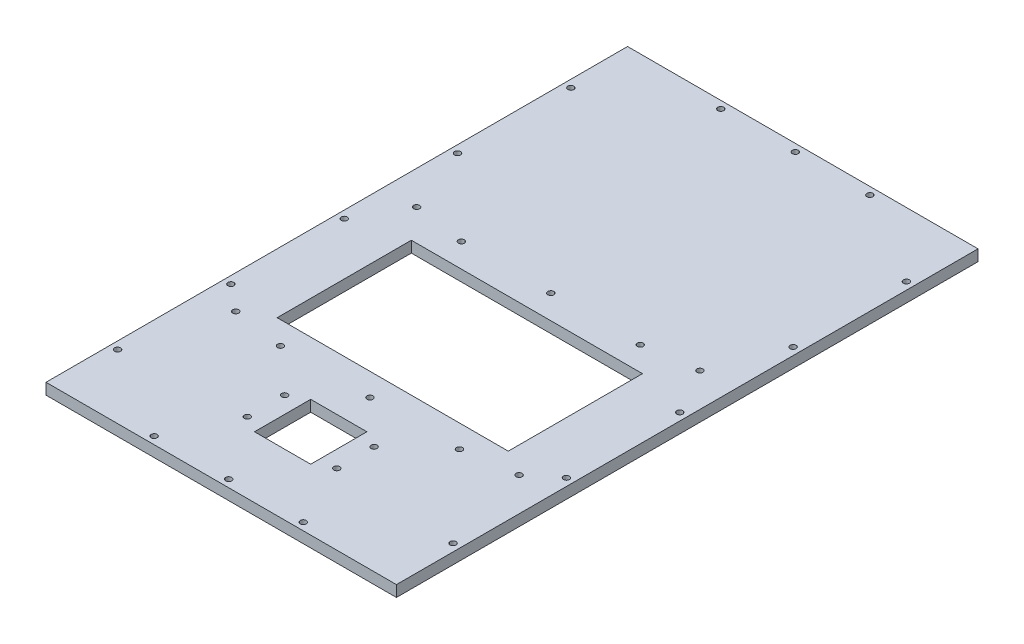
from build123d import *

# Parameters (mm, degrees)
SKETCH1_W                  = 298.45
SKETCH1_H                  = 495.3
BOSS_EXTRUDE1_DEPTH        = 4.7625
CUT_EXTRUDE1_DEPTH         = 290.291114191
CUT_EXTRUDE1_DEPTH_BACK    = 290.291114191
SKETCH3_W                  = 196.85
SKETCH3_H                  = 114.3
SKETCH20_W                 = 47.879
SKETCH20_H                 = 47.879
CUT_EXTRUDE5_DEPTH         = 290.291114191
F_10_CLEARANCE_HOLE1_D     = 5.1054
F_10_CLEARANCE_HOLE1_DEPTH = 10.668
F_10_CLEARANCE_HOLE1_TIP   = 1.533816902
F_10_CLEARANCE_HOLE4_D     = 5.1054
LPATTERN3_COUNT            = 3
LPATTERN3_PITCH            = 63.5
MIRROR2_COPY_1_D           = 5.1054
MIRROR2_COPY_2_D           = 5.1054
F_10_CLEARANCE_HOLE5_D     = 5.1054
LPATTERN4_COUNT            = 3
LPATTERN4_PITCH            = 96.52
LPATTERN4_COL_COUNT        = 3
LPATTERN4_COL_PITCH        = 96.52
MIRROR3_COPY_1_D           = 5.1054
MIRROR3_COPY_2_D           = 5.1054
MIRROR3_COPY_3_D           = 5.1054
MIRROR3_COPY_4_D           = 5.1054
F_10_CLEARANCE_HOLE6_D     = 5.1054
F_10_CLEARANCE_HOLE7_D     = 5.1054


with BuildPart() as part:
    # Sketch1 → Boss-Extrude1 (new, symmetric)
    with BuildSketch(Plane(origin=(0, 0, 0), x_dir=(1, 0, 0), z_dir=(0, 1, 0))):
        Rectangle(SKETCH1_W, SKETCH1_H)
    extrude(amount=BOSS_EXTRUDE1_DEPTH, both=True)

    # Sketch3 → Cut-Extrude1 (cut, two sides: drawn at the far end of the back side and taken through both)
    with BuildSketch(Plane(origin=(0, 4.7625, 0), x_dir=(1, 0, 0), z_dir=(0, 1, 0)).offset(-CUT_EXTRUDE1_DEPTH_BACK)):
        with Locations((0, -44.45)):
            Rectangle(SKETCH3_W, SKETCH3_H)
    extrude(amount=CUT_EXTRUDE1_DEPTH + CUT_EXTRUDE1_DEPTH_BACK, mode=Mode.SUBTRACT)

    # Sketch20 → Cut-Extrude5 (cut, through all)
    with BuildSketch(Plane.XZ.offset(4.7625)):
        with Locations((0, 171.45)):
            Rectangle(SKETCH20_W, SKETCH20_H)
    extrude(amount=-CUT_EXTRUDE5_DEPTH, mode=Mode.SUBTRACT)

    # #10 Clearance Hole1
    with Locations(Plane(origin=(0, -4.7625, 0), x_dir=(-1, 0, 0), z_dir=(0, -1, 0))):
        with Locations((-38.1, -155.575), (38.1, -155.575), (38.1, -187.325), (-38.1, -187.325)):
            Hole(F_10_CLEARANCE_HOLE1_D / 2, depth=F_10_CLEARANCE_HOLE1_DEPTH)
            with Locations((0, 0, -(F_10_CLEARANCE_HOLE1_DEPTH + F_10_CLEARANCE_HOLE1_TIP / 2))):  # 118° drill point
                Cone(0, F_10_CLEARANCE_HOLE1_D / 2, F_10_CLEARANCE_HOLE1_TIP, mode=Mode.SUBTRACT)

    # #10 Clearance Hole4 (through all)
    with Locations(Plane(origin=(0, 4.7625, 0), x_dir=(1, 0, 0), z_dir=(0, 1, 0))):
        with Locations((-63.5, 241.3)):
            f_10_clearance_hole4 = Hole(F_10_CLEARANCE_HOLE4_D / 2)

    # LPattern3: #10 Clearance Hole4 ×3
    with Locations(*[(i * LPATTERN3_PITCH, 0, 0) for i in range(1, LPATTERN3_COUNT)]):
        add(f_10_clearance_hole4, mode=Mode.SUBTRACT)

    # Mirror2: #10 Clearance Hole4 across plane
    add(f_10_clearance_hole4.mirror(Plane.XY), mode=Mode.SUBTRACT)

    # Mirror2 copy 1 (through all)
    with Locations(Plane(origin=(63.5, 4.7625, 0), x_dir=(1, 0, 0), z_dir=(0, 1, 0))):
        with Locations((-63.5, -241.3)):
            Hole(MIRROR2_COPY_1_D / 2)

    # Mirror2 copy 2 (through all)
    with Locations(Plane(origin=(127, 4.7625, 0), x_dir=(1, 0, 0), z_dir=(0, 1, 0))):
        with Locations((-63.5, -241.3)):
            Hole(MIRROR2_COPY_2_D / 2)

    # #10 Clearance Hole5 (through all)
    with Locations(Plane(origin=(0, 4.7625, 0), x_dir=(1, 0, 0), z_dir=(0, 1, 0))):
        with Locations((-142.875, 0)):
            f_10_clearance_hole5 = Hole(F_10_CLEARANCE_HOLE5_D / 2)

    # LPattern4: #10 Clearance Hole5 ×3
    with Locations(*[(0, 0, -i * LPATTERN4_PITCH) for i in range(1, LPATTERN4_COUNT)]):
        add(f_10_clearance_hole5, mode=Mode.SUBTRACT)

    # LPattern4 col: #10 Clearance Hole5 ×3
    with Locations(*[(0, 0, i * LPATTERN4_COL_PITCH) for i in range(1, LPATTERN4_COL_COUNT)]):
        add(f_10_clearance_hole5, mode=Mode.SUBTRACT)

    # Mirror3: #10 Clearance Hole5 across plane
    add(f_10_clearance_hole5.mirror(Plane(origin=(0, 0, 0), x_dir=(0, 0, 1), z_dir=(1, 0, 0))), mode=Mode.SUBTRACT)

    # Mirror3 copy 1 (through all)
    with Locations(Plane(origin=(0, 4.7625, -96.52), x_dir=(-1, 0, 0), z_dir=(0, 1, 0))):
        with Locations((-142.875, 0)):
            Hole(MIRROR3_COPY_1_D / 2)

    # Mirror3 copy 2 (through all)
    with Locations(Plane(origin=(0, 4.7625, -193.04), x_dir=(-1, 0, 0), z_dir=(0, 1, 0))):
        with Locations((-142.875, 0)):
            Hole(MIRROR3_COPY_2_D / 2)

    # Mirror3 copy 3 (through all)
    with Locations(Plane(origin=(0, 4.7625, 96.52), x_dir=(-1, 0, 0), z_dir=(0, 1, 0))):
        with Locations((-142.875, 0)):
            Hole(MIRROR3_COPY_3_D / 2)

    # Mirror3 copy 4 (through all)
    with Locations(Plane(origin=(0, 4.7625, 193.04), x_dir=(-1, 0, 0), z_dir=(0, 1, 0))):
        with Locations((-142.875, 0)):
            Hole(MIRROR3_COPY_4_D / 2)

    # #10 Clearance Hole6 (through all)
    with Locations(Plane(origin=(0, 4.7625, 0), x_dir=(1, 0, 0), z_dir=(0, 1, 0))):
        with Locations((120.65, 39.4255), (120.65, -114.6255), (-120.65, -114.6255), (-120.65, 39.4255)):
            Hole(F_10_CLEARANCE_HOLE6_D / 2)

    # #10 Clearance Hole7 (through all)
    with Locations(Plane(origin=(0, 4.7625, 0), x_dir=(1, 0, 0), z_dir=(0, 1, 0))):
        with Locations((76.2, 33.0755), (0, 33.0755), (-76.2, 33.0755), (-76.2, -120.9755), (0, -120.9755), (76.2, -120.9755)):
            Hole(F_10_CLEARANCE_HOLE7_D / 2)


solid = part.part
